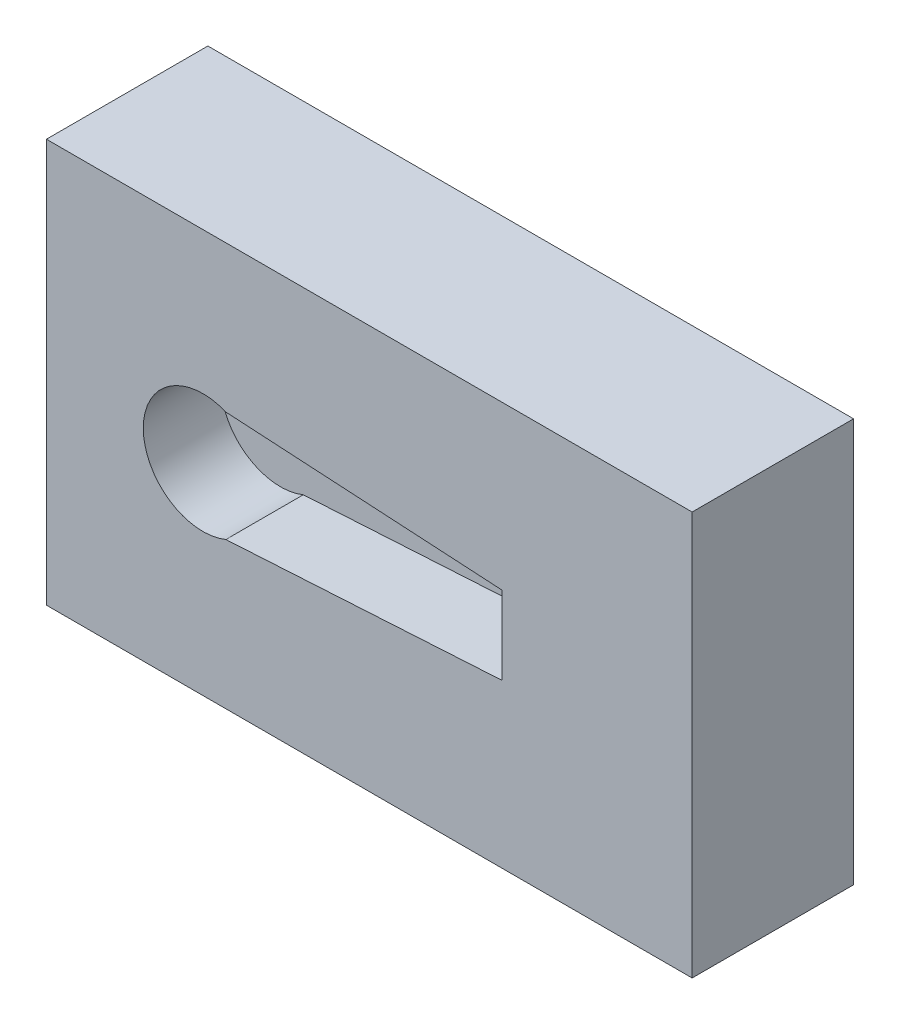
from build123d import *

# Parameters (mm, degrees)
SKETCH2_W           = 40
SKETCH2_H           = 25
BOSS_EXTRUDE1_DEPTH = 15
SKETCH3_W           = 25
SKETCH3_H           = 12
CUT_EXTRUDE1_DEPTH  = 5
CUT_EXTRUDE2_DEPTH  = 4.8
SKETCH7_W           = 40
SKETCH7_H           = 25
CUT_EXTRUDE3_DEPTH  = 5


with BuildPart() as part:
    # Sketch2 → Boss-Extrude1 (new body)
    with BuildSketch(Plane.XY):
        with Locations((2.333785617, 1.285617368)):
            Rectangle(SKETCH2_W, SKETCH2_H)
    extrude(amount=BOSS_EXTRUDE1_DEPTH)

    # Sketch3 → Cut-Extrude1 (cut)
    with BuildSketch(Plane.XY.offset(15)):
        with Locations((-0.166214383, 1.285617368)):
            Rectangle(SKETCH3_W, SKETCH3_H)
    extrude(amount=-CUT_EXTRUDE1_DEPTH, mode=Mode.SUBTRACT)

    # Sketch5 → Cut-Extrude2 (cut)
    with BuildSketch(Plane.XY.offset(10)):
        with BuildLine():
            Line((10.563785617, -1.134382632), (10.563785617, 3.705617368))
            Line((10.563785617, 3.705617368), (-6.554265375, 4.705617368))
            ThreePointArc((-6.554265375, 4.705617368), (-11.666214383, 1.285617368), (-6.554265375, -2.134382632))
            Line((-6.554265375, -2.134382632), (10.563785617, -1.134382632))
        make_face()
    extrude(amount=-CUT_EXTRUDE2_DEPTH, mode=Mode.SUBTRACT)

    # Sketch7 → Cut-Extrude3 (cut)
    with BuildSketch(Plane.XY.offset(15)):
        with Locations((2.333785617, 1.285617368)):
            Rectangle(SKETCH7_W, SKETCH7_H)
    extrude(amount=-CUT_EXTRUDE3_DEPTH, mode=Mode.SUBTRACT)


solid = part.part
